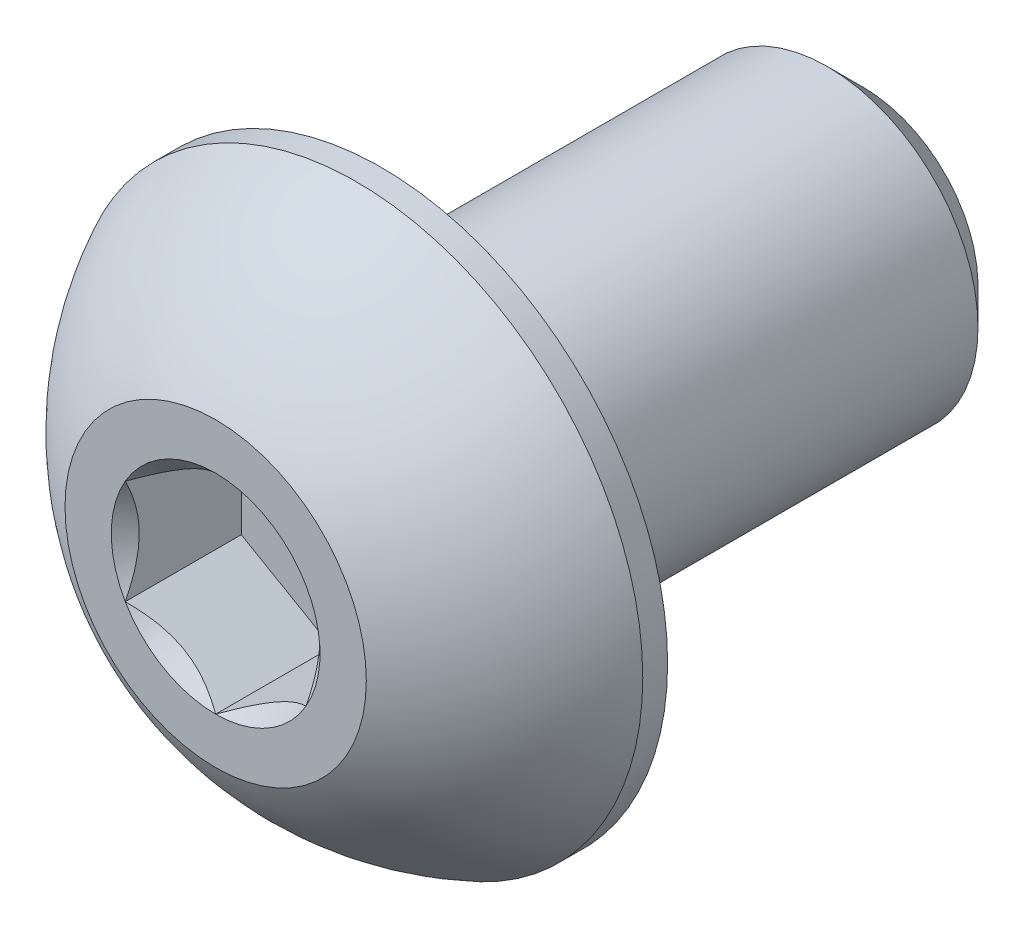
from build123d import *

# Parameters (mm, degrees)
SKETCH1_W          = 8
SKETCH1_H          = 2.5
CHAMFER1_SIZE      = 0.6
CUT_EXTRUDE2_DEPTH = 1.925


with BuildPart() as part:
    # Sketch1 → Revolve1 (revolve)
    with BuildSketch(Plane(origin=(0, 0, 0), x_dir=(0, 0, -1), z_dir=(1, 0, 0))):
        with Locations((6.75, 1.25)):
            Rectangle(SKETCH1_W, SKETCH1_H)
    revolve(axis=Axis((0, 0, -10.75), (0, 0, 1)))

    # Chamfer1
    chamfer1_edges = [part.edges().sort_by_distance(p)[0] for p in [
        (0, -2.5, -10.75),
    ]]
    chamfer(chamfer1_edges, length=CHAMFER1_SIZE)

    # Sketch7 → Revolve2 (revolve)
    with BuildSketch(Plane(origin=(0, 0, 0), x_dir=(0, 0, -1), z_dir=(1, 0, 0))):
        with BuildLine():
            Line((2.3375, 4.75), (2.75, 4.75))
            Line((2.75, 4.75), (2.75, 0))
            Line((2.75, 0), (0, 0))
            Line((0, 0), (0, 2.5))
            ThreePointArc((0, 2.5), (0.991875183, 3.808753282), (2.3375, 4.75))
        make_face()
    revolve(axis=Axis((0, 0, 0), (0, 0, -1)))

    # Sketch5 → Cut-Extrude2 (cut)
    with BuildSketch(Plane.XY):
        Polygon((1.5, -0.866025404), (1.5, 0.866025404), (0, 1.732050808), (-1.5, 0.866025404), (-1.5, -0.866025404), (0, -1.732050808), align=None)
    extrude(amount=-CUT_EXTRUDE2_DEPTH, mode=Mode.SUBTRACT)

    # Cut-Extrude3 cone 1 section (through the dimple's axis) → Cut-Extrude3 (revolve, cut)
    with BuildSketch(Plane(origin=(0, 0, 0), x_dir=(0, -1, 0), z_dir=(1, 0, 0))):
        Polygon((0, 0), (1.732050808, 0), (0, 1.732050808), align=None)
    revolve(axis=Axis((0, 0, 0), (0, 0, -1)), mode=Mode.SUBTRACT)


solid = part.part
